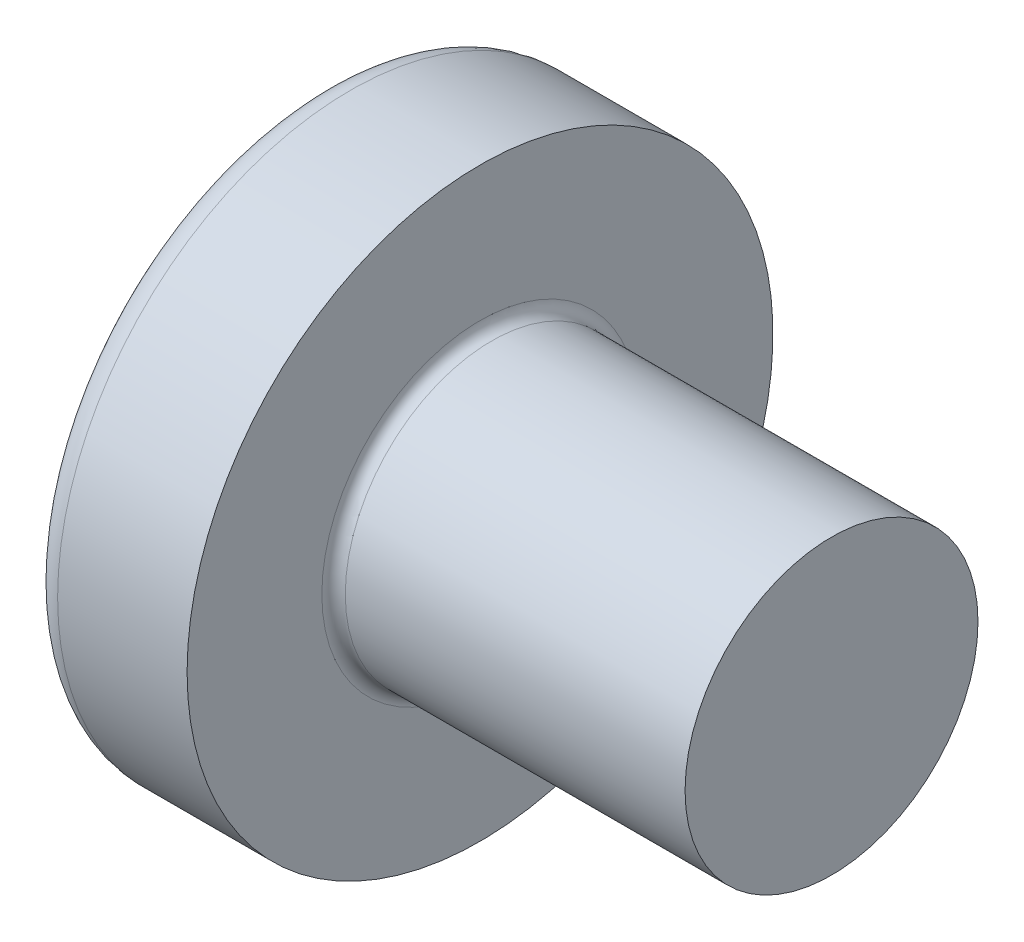
from build123d import *

# Parameters (mm, degrees)
FILLET1_R    = 0.1
RECPAT_COUNT = 2
RECPAT_ANGLE = 90


with BuildPart() as part:
    # BodySke → Base-Revolve (revolve)
    with BuildSketch(Plane.XY, mode=Mode.PRIVATE) as base_revolve_sk:
        with BuildLine():
            Line((2.1, 1.25), (2.1, 2.5))
            Line((2.1, 2.5), (0.99500416, 2.5))
            ThreePointArc((0.99500416, 2.5), (0.88781572, 2.474733878), (0.803195915, 2.404255319))
            ThreePointArc((0.803195915, 2.404255319), (0.206109099, 1.267435138), (0, 0))
            Line((0, 0), (5.1, 0))
            Line((5.1, 0), (5.1, 1.25))
            Line((5.1, 1.25), (2.1, 1.25))
        make_face()
    revolve(base_revolve_sk.sketch.rotate(Axis((0.99500416, 0, 0), (1, 0, 0)), 90), axis=Axis((0.99500416, 0, 0), (1, 0, 0)))

    # Fillet1
    fillet1_edges = [part.edges().sort_by_distance(p)[0] for p in [
        (2.1, 0, -1.25),
    ]]
    fillet(fillet1_edges, radius=FILLET1_R)

    # Sketch3 → Recess section 0
    with BuildSketch(Plane(origin=(0, 0, 0), x_dir=(0, 0, -1), z_dir=(1, 0, 0))):
        with BuildLine():
            Line((0.37, -1.3), (-0.37, -1.3))
            Line((-0.37, -1.3), (-0.37, 1.3))
            Line((-0.37, 1.3), (0.37, 1.3))
            Line((0.37, 1.3), (0.37, -1.3))
        make_face()
    # Sketch4 → Recess section 1
    with BuildSketch(Plane(origin=(1.5, 0, 0), x_dir=(0, 0, -1), z_dir=(1, 0, 0))):
        with BuildLine():
            Line((0.37, -0.552127713), (-0.37, -0.552127713))
            Line((-0.37, -0.552127713), (-0.37, 0.552127713))
            Line((-0.37, 0.552127713), (0.37, 0.552127713))
            Line((0.37, 0.552127713), (0.37, -0.552127713))
        make_face()
    recess = loft(mode=Mode.SUBTRACT)

    # RecPat: Recess ×2 about axis
    recpat_axis = Axis((0, 0, 0), (1, 0, 0))
    for i in range(1, RECPAT_COUNT):
        add(recess.rotate(recpat_axis, i * RECPAT_ANGLE / (RECPAT_COUNT - 1)), mode=Mode.SUBTRACT)

    # RecCorSke → RecessCore (revolve, cut)
    with BuildSketch(Plane.XY, mode=Mode.PRIVATE) as recesscore_sk:
        Polygon((0, 0), (0, 0.660890218), (1.5, 0.556), (1.680655351, 0), align=None)
    revolve(recesscore_sk.sketch.rotate(Axis((-3.175, 0, 0), (1, 0, 0)), 342.85413457), axis=Axis((-3.175, 0, 0), (1, 0, 0)), mode=Mode.SUBTRACT)


solid = part.part
